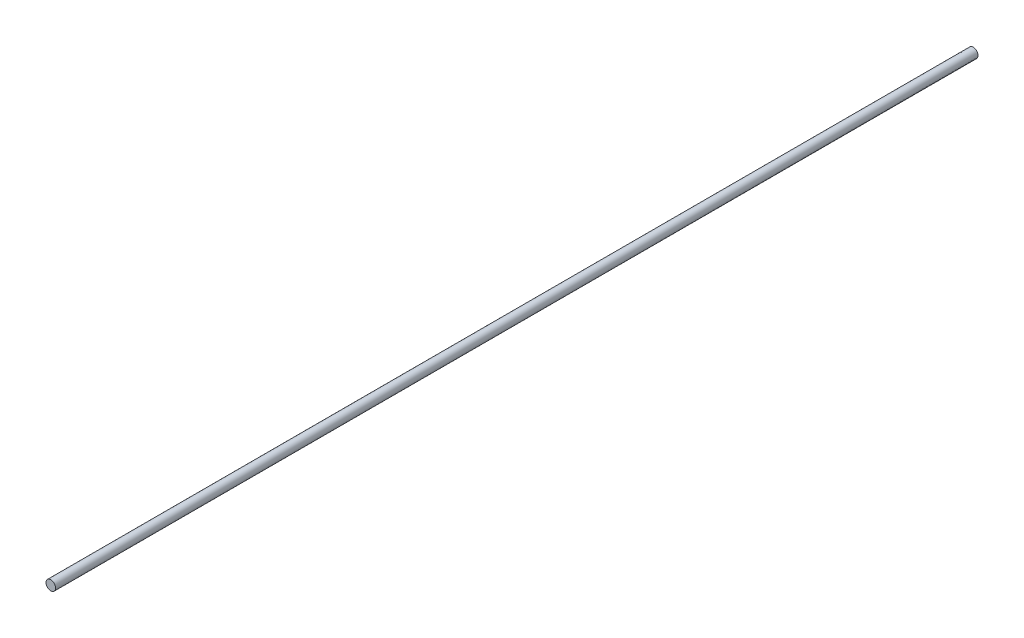
from build123d import *

# Parameters (mm, degrees)
SKETCH1_R           = 6.35
BOSS_EXTRUDE1_DEPTH = 1219.2


with BuildPart() as part:
    # Sketch1 → Boss-Extrude1 (new body)
    with BuildSketch(Plane.XY):
        with Locations(Location((0, 0, 0), (0, 0, 180))):
            Circle(SKETCH1_R)
    extrude(amount=BOSS_EXTRUDE1_DEPTH)


solid = part.part
